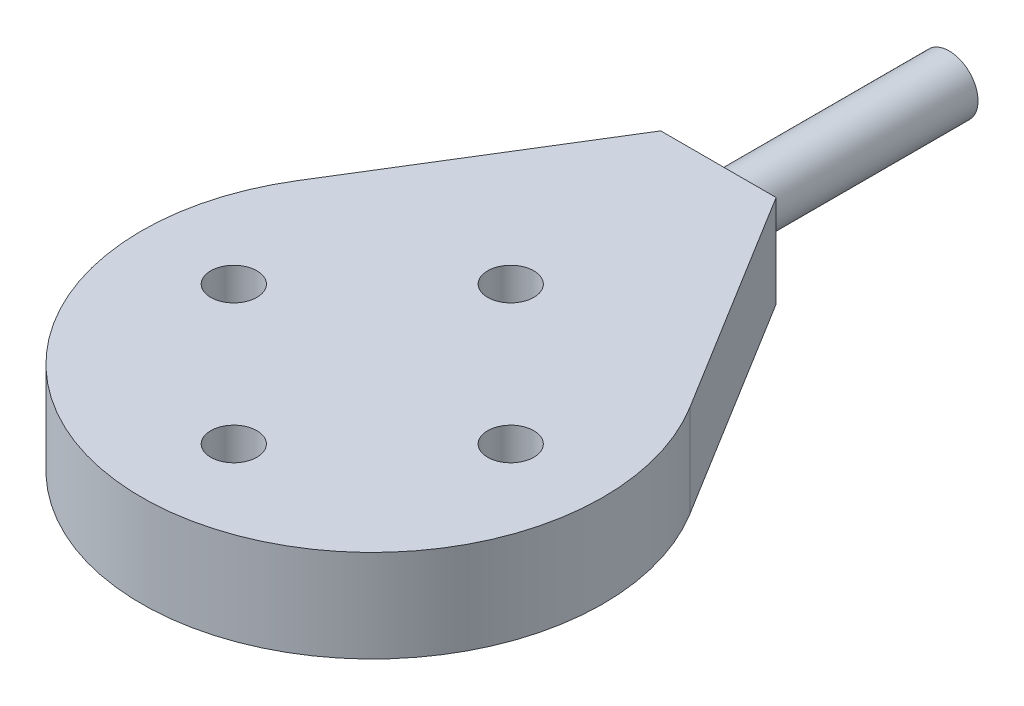
from build123d import *

# Parameters (mm, degrees)
SKETCH1_R           = 1.27
BOSS_EXTRUDE1_DEPTH = 5.08
SKETCH2_R           = 1.5875
BOSS_EXTRUDE2_DEPTH = 12.7


with BuildPart() as part:
    # Sketch1 → Boss-Extrude1 (new body)
    with BuildSketch(Plane(origin=(0, 0, 0), x_dir=(1, 0, 0), z_dir=(0, 1, 0))):
        with BuildLine():
            Line((-10.810601837, 6.664899694), (-3.175, 19.05))
            Line((-3.175, 19.05), (3.175, 19.05))
            Line((3.175, 19.05), (10.810601837, 6.664899694))
            ThreePointArc((10.810601837, 6.664899694), (0, -12.7), (-10.810601837, 6.664899694))
        make_face()
        with Locations(Location((0, 7.62, 0), (0, 0, 270))):
            Circle(SKETCH1_R, mode=Mode.SUBTRACT)
        with Locations(Location((7.62, 0, 0), (0, 0, 270))):
            Circle(SKETCH1_R, mode=Mode.SUBTRACT)
        with Locations(Location((0, -7.62, 0), (0, 0, 270))):
            Circle(SKETCH1_R, mode=Mode.SUBTRACT)
        with Locations(Location((-7.62, 0, 0), (0, 0, 270))):
            Circle(SKETCH1_R, mode=Mode.SUBTRACT)
    extrude(amount=BOSS_EXTRUDE1_DEPTH)

    # Sketch2 → Boss-Extrude2 (add)
    with BuildSketch(Plane(origin=(0, 0, -19.05), x_dir=(-1, 0, 0), z_dir=(0, 0, -1))):
        with Locations((0, 2.54)):
            Circle(SKETCH2_R)
    extrude(amount=BOSS_EXTRUDE2_DEPTH)


solid = part.part
